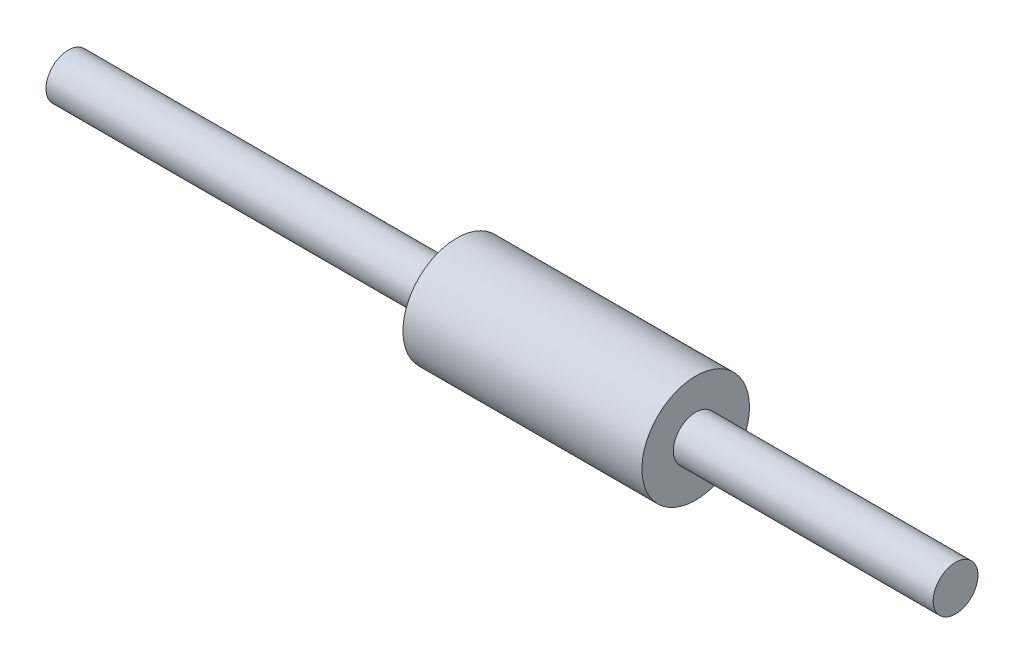
from build123d import *

# Parameters (mm, degrees)
SKETCH1_W = 80
SKETCH1_H = 10.5


with BuildPart() as part:
    # Sketch1 → Revolve1 (revolve)
    with BuildSketch(Plane.XY, mode=Mode.PRIVATE) as revolve1_sk:
        with Locations((0, 12.75)):
            Rectangle(SKETCH1_W, SKETCH1_H)
        Polygon((-170, 6.5), (-127, 6.5), (-127, 0), (127, 0), (127, 7.5), (-170, 7.5), align=None)
    revolve(revolve1_sk.sketch.rotate(Axis((196.356223274, 0, 0), (-1, 0, 0)), 90), axis=Axis((196.356223274, 0, 0), (-1, 0, 0)))


solid = part.part
